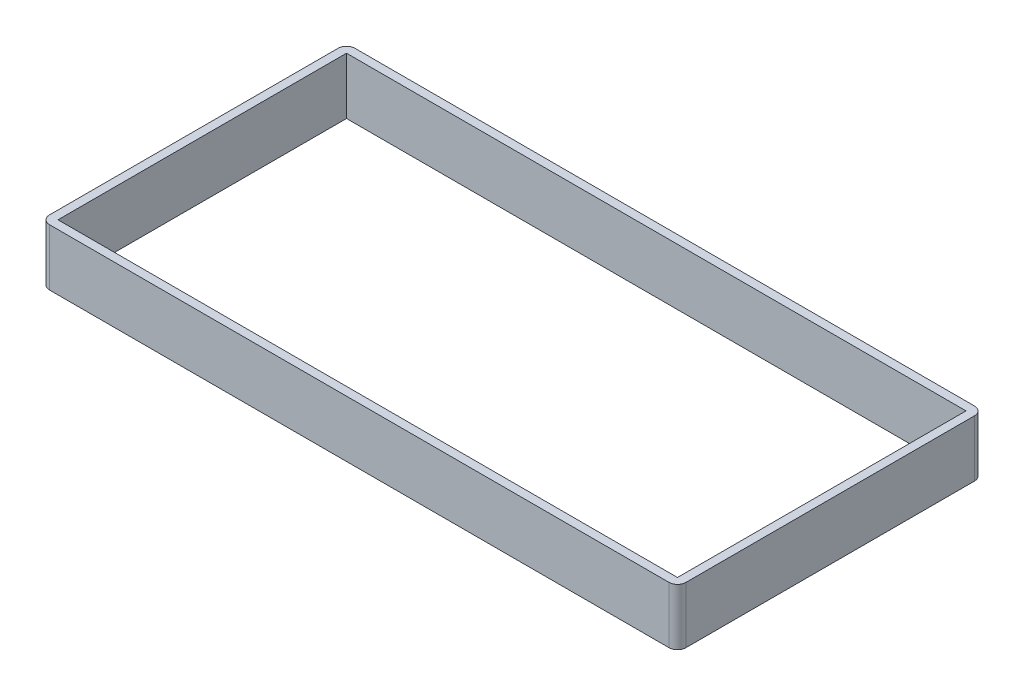
from build123d import *

# Parameters (mm, degrees)
SKETCH1_W           = 225
SKETCH1_H           = 108
SKETCH1_W_2         = 219
SKETCH1_H_2         = 102
EXTRUDE_THIN1_DEPTH = 10
FILLET1_R           = 3


with BuildPart() as part:
    # Sketch1 → Extrude-Thin1 (new, symmetric)
    with BuildSketch(Plane(origin=(0, 0, 0), x_dir=(1, 0, 0), z_dir=(0, 1, 0))):
        Rectangle(SKETCH1_W, SKETCH1_H)
        Rectangle(SKETCH1_W_2, SKETCH1_H_2, mode=Mode.SUBTRACT)
    extrude(amount=EXTRUDE_THIN1_DEPTH, both=True)

    # Fillet1
    fillet1_edges = [part.edges().sort_by_distance(p)[0] for p in [
        (-112.5, 0, -54),
        (112.5, 0, -54),
        (112.5, 0, 54),
        (-112.5, 0, 54),
    ]]
    fillet(fillet1_edges, radius=FILLET1_R)


solid = part.part
